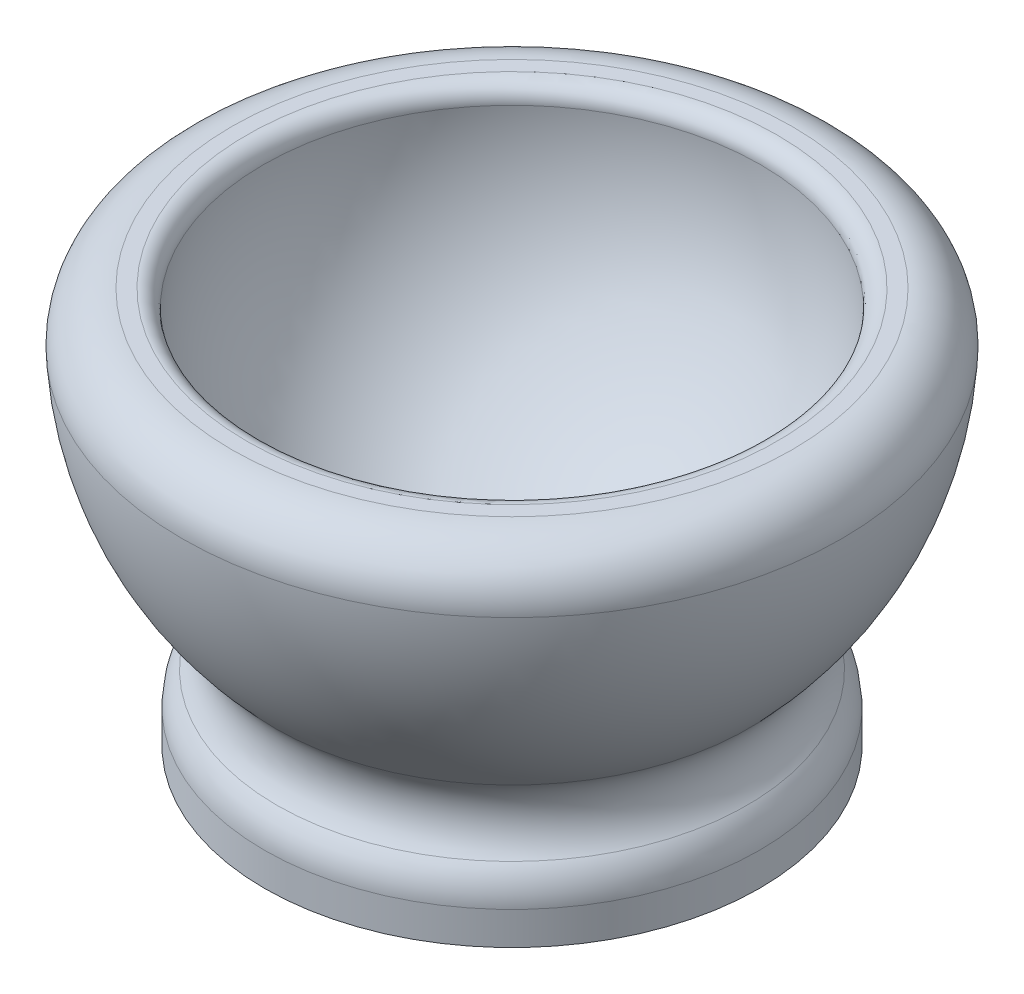
from build123d import *

# Parameters (mm, degrees)
CUT_EXTRUDE_1_DEPTH      = 35.641016151
CUT_EXTRUDE_1_DEPTH_BACK = 35.641016151
SKETCH_2_W               = 73.47601024
SKETCH_2_H               = 33
FILLET_1_R               = 1
EXTRUDE_1_REACH          = 52.636
EXTRUDE_1_END_RADIUS     = 20
SKETCH_3_R               = 6
SKETCH_4_R               = 15
EXTRUDE_2_DEPTH          = 5
FILLET_3_R               = 3
FILLET_4_R               = 3
FILLET_5_R               = 3


with BuildPart() as part:
    # 草图1 → 旋转5 (revolve)
    with BuildSketch(Plane(origin=(0, 0, 0), x_dir=(1, 0, 0), z_dir=(0, 1, 0))):
        with BuildLine():
            Line((-15.1, 0), (-20, 0))
            ThreePointArc((-20, 0), (0, -20), (20, 0))
            Line((20, 0), (15.1, 0))
            ThreePointArc((15.1, 0), (0, -15.1), (-15.1, 0))
        make_face()
    revolve(axis=Axis((-24.083513492, 0, 0), (1, 0, 0)))

    # 草图2 → 切除-拉伸1 (cut, two sides: drawn at the far end of the back side and taken through both)
    with BuildSketch(Plane(origin=(0, 0, 0), x_dir=(0, 0, -1), z_dir=(1, 0, 0)).offset(-CUT_EXTRUDE_1_DEPTH_BACK)):
        with Locations((-0.442626568, 18.5)):
            Rectangle(SKETCH_2_W, SKETCH_2_H)
    extrude(amount=CUT_EXTRUDE_1_DEPTH + CUT_EXTRUDE_1_DEPTH_BACK, mode=Mode.SUBTRACT)

    # 圆角1
    fillet_1_edges = [part.edges().sort_by_distance(p)[0] for p in [
        (0, 2, 14.96696362),
    ]]
    fillet(fillet_1_edges, radius=FILLET_1_R)

    # 凸台-拉伸1: up to this sphere (the profile starts outside it)
    extrude_1_end = Location((0, 0, 0)) * Sphere(EXTRUDE_1_END_RADIUS, mode=Mode.PRIVATE)
    # 草图3 → 凸台-拉伸1 (add, up to the surface)
    with BuildSketch(Plane(origin=(0, -22, 0), x_dir=(1, 0, 0), z_dir=(0, 1, 0)), mode=Mode.PRIVATE) as extrude_1_sk1:
        with Locations(Location((0, 0, 0), (0, 0, 270))):
            Circle(SKETCH_3_R)
    extrude_1_tool1 = extrude(extrude_1_sk1.sketch, amount=EXTRUDE_1_REACH, mode=Mode.PRIVATE) - extrude_1_end
    add(extrude_1_tool1.solids().sort_by_distance((0, -22, 0))[0])

    # 草图4 → 凸台-拉伸2 (add)
    with BuildSketch(Plane(origin=(0, -22, 0), x_dir=(-1, 0, 0), z_dir=(0, -1, 0))):
        with Locations(Location((0, 0, 0), (0, 0, 90))):
            Circle(SKETCH_4_R)
    extrude(amount=-EXTRUDE_2_DEPTH)

    # 圆角3
    fillet_3_edges = [part.edges().sort_by_distance(p)[0] for p in [
        (0, 2, 19.899748742),
    ]]
    fillet(fillet_3_edges, radius=FILLET_3_R)

    # 圆角4
    fillet_4_edges = [part.edges().sort_by_distance(p)[0] for p in [
        (0, -17, 15),
    ]]
    fillet(fillet_4_edges, radius=FILLET_4_R)

    # 圆角5
    fillet_5_edges = [part.edges().sort_by_distance(p)[0] for p in [
        (0, -17, 10.535653753),
    ]]
    fillet(fillet_5_edges, radius=FILLET_5_R)


solid = part.part
